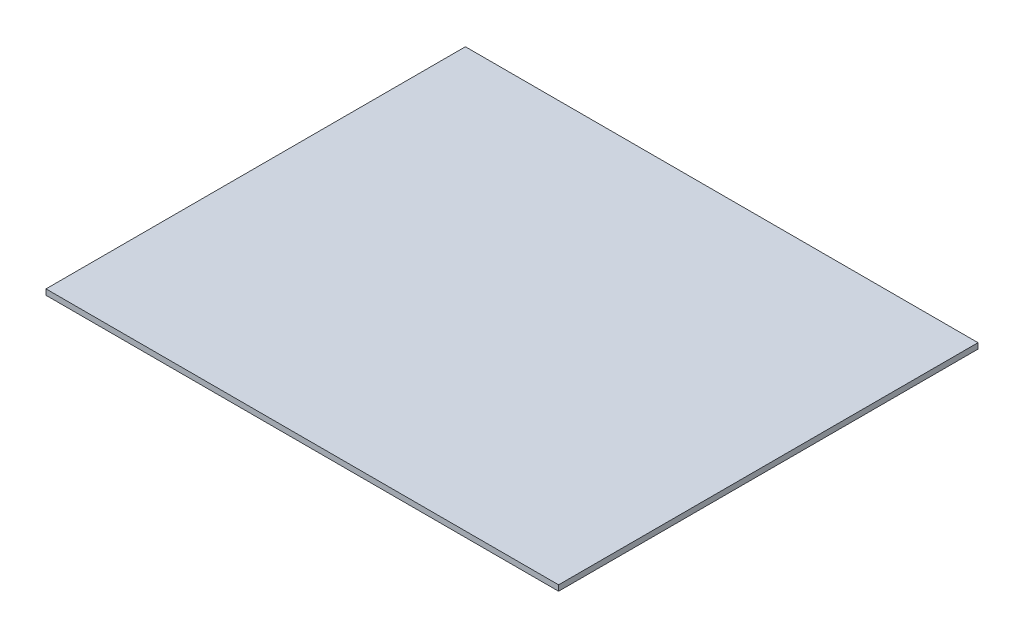
from build123d import *

# Parameters (mm, degrees)
SKETCH1_W           = 1100
SKETCH1_H           = 900
BOSS_EXTRUDE1_DEPTH = 6


with BuildPart() as part:
    # Sketch1 → Boss-Extrude1 (new, symmetric)
    with BuildSketch(Plane(origin=(0, 0, 0), x_dir=(1, 0, 0), z_dir=(0, 1, 0))):
        Rectangle(SKETCH1_W, SKETCH1_H)
    extrude(amount=BOSS_EXTRUDE1_DEPTH, both=True)


solid = part.part
